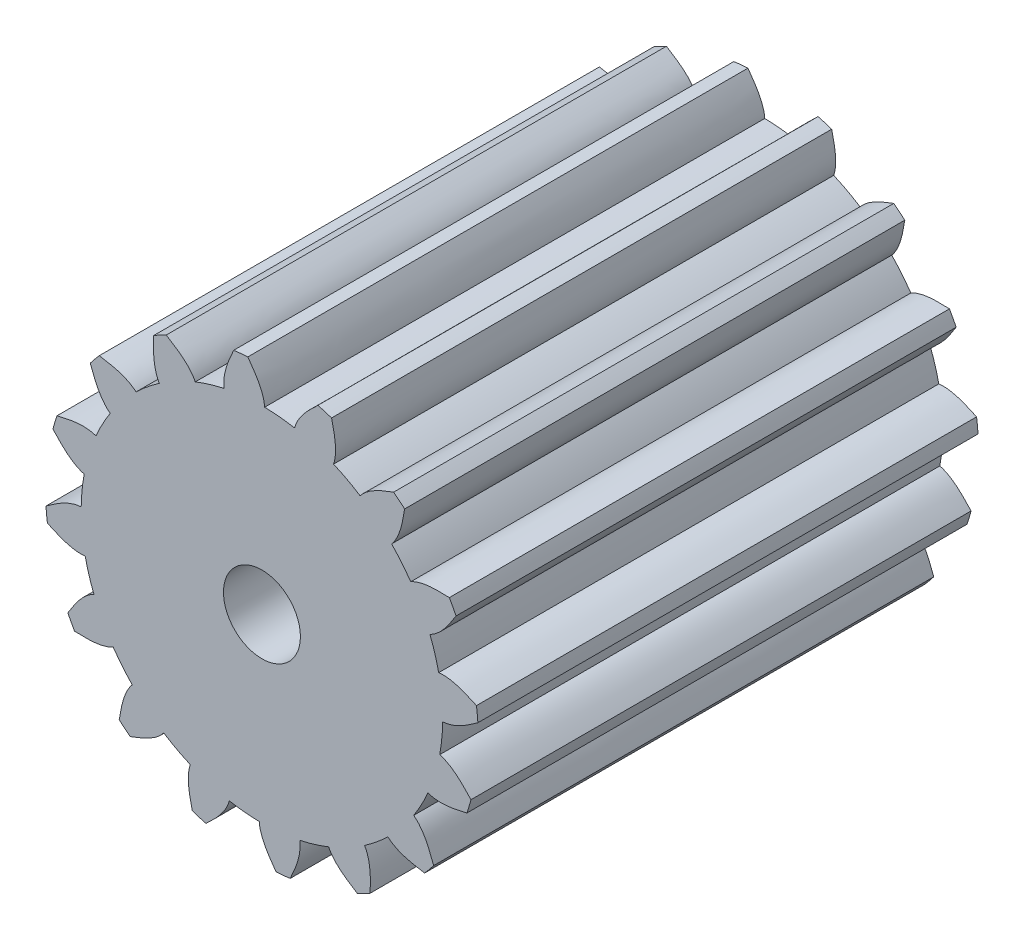
from build123d import *

# Parameters (mm, degrees)
BOSS_EXTRUDE7_DEPTH = 5.2
CIRPATTERN1_COUNT   = 16
DIAMETRO_BASE_R     = 1.879385242
BOSS_EXTRUDE9_DEPTH = 5.2
MOZZO_R             = 0.4
CUT_EXTRUDE1_DEPTH  = 5.2


with BuildPart() as part:
    # profilo → Boss-Extrude7 (new body)
    with BuildSketch(Plane.XY):
        with BuildLine():
            Line((-0.220538566, 2.239165635), (-0.184211967, 1.870335488))
            ThreePointArc((-0.184211967, 1.870335488), (-0.078225963, 1.87775653), (0.028010042, 1.879176501))
            add(Edge.make_bspline(
                [(-0.14670524, 2.245212144), (-0.068888242, 2.136288179), (0.01902302, 2.014536344), (0.028010042, 1.879176501)],
                knots=[0.201514188, 0.201514188, 0.201514188, 0.201514188, 1, 1, 1, 1], degree=3))
            ThreePointArc((-0.14670524, 2.245212144), (-0.18364679, 2.242492777), (-0.220538566, 2.239165635))
        make_face()
    extrude(amount=BOSS_EXTRUDE7_DEPTH)

    # Mirror1: part across plane


with BuildPart() as part_1:
    add(part.part)
    add(part.part.mirror(Plane(origin=(0, 0, 0), x_dir=(0, 0, 1), z_dir=(0.9951847266721969, 0.09801714032956144, 0))))


with BuildPart() as cirpattern1_1:
    # CirPattern1: pattern copy
    add(part_1.part.rotate(Axis((0, 0, 5.2), (0, 0, 1)), 1 * 360 / CIRPATTERN1_COUNT))


with BuildPart() as cirpattern1_2:
    # CirPattern1: pattern copy
    add(part_1.part.rotate(Axis((0, 0, 5.2), (0, 0, 1)), 2 * 360 / CIRPATTERN1_COUNT))


with BuildPart() as cirpattern1_3:
    # CirPattern1: pattern copy
    add(part_1.part.rotate(Axis((0, 0, 5.2), (0, 0, 1)), 3 * 360 / CIRPATTERN1_COUNT))


with BuildPart() as cirpattern1_4:
    # CirPattern1: pattern copy
    add(part_1.part.rotate(Axis((0, 0, 5.2), (0, 0, 1)), 4 * 360 / CIRPATTERN1_COUNT))


with BuildPart() as cirpattern1_5:
    # CirPattern1: pattern copy
    add(part_1.part.rotate(Axis((0, 0, 5.2), (0, 0, 1)), 5 * 360 / CIRPATTERN1_COUNT))


with BuildPart() as cirpattern1_6:
    # CirPattern1: pattern copy
    add(part_1.part.rotate(Axis((0, 0, 5.2), (0, 0, 1)), 6 * 360 / CIRPATTERN1_COUNT))


with BuildPart() as cirpattern1_7:
    # CirPattern1: pattern copy
    add(part_1.part.rotate(Axis((0, 0, 5.2), (0, 0, 1)), 7 * 360 / CIRPATTERN1_COUNT))


with BuildPart() as cirpattern1_8:
    # CirPattern1: pattern copy
    add(part_1.part.rotate(Axis((0, 0, 5.2), (0, 0, 1)), 8 * 360 / CIRPATTERN1_COUNT))


with BuildPart() as cirpattern1_9:
    # CirPattern1: pattern copy
    add(part_1.part.rotate(Axis((0, 0, 5.2), (0, 0, 1)), 9 * 360 / CIRPATTERN1_COUNT))


with BuildPart() as cirpattern1_10:
    # CirPattern1: pattern copy
    add(part_1.part.rotate(Axis((0, 0, 5.2), (0, 0, 1)), 10 * 360 / CIRPATTERN1_COUNT))


with BuildPart() as cirpattern1_11:
    # CirPattern1: pattern copy
    add(part_1.part.rotate(Axis((0, 0, 5.2), (0, 0, 1)), 11 * 360 / CIRPATTERN1_COUNT))


with BuildPart() as cirpattern1_12:
    # CirPattern1: pattern copy
    add(part_1.part.rotate(Axis((0, 0, 5.2), (0, 0, 1)), 12 * 360 / CIRPATTERN1_COUNT))


with BuildPart() as cirpattern1_13:
    # CirPattern1: pattern copy
    add(part_1.part.rotate(Axis((0, 0, 5.2), (0, 0, 1)), 13 * 360 / CIRPATTERN1_COUNT))


with BuildPart() as cirpattern1_14:
    # CirPattern1: pattern copy
    add(part_1.part.rotate(Axis((0, 0, 5.2), (0, 0, 1)), 14 * 360 / CIRPATTERN1_COUNT))


with BuildPart() as cirpattern1_15:
    # CirPattern1: pattern copy
    add(part_1.part.rotate(Axis((0, 0, 5.2), (0, 0, 1)), 15 * 360 / CIRPATTERN1_COUNT))


with BuildPart() as part_2:
    add(part_1.part)

    add(cirpattern1_1.part)  # Boss-Extrude9 merges CirPattern1_1

    add(cirpattern1_2.part)  # Boss-Extrude9 merges CirPattern1_2

    add(cirpattern1_3.part)  # Boss-Extrude9 merges CirPattern1_3

    add(cirpattern1_4.part)  # Boss-Extrude9 merges CirPattern1_4

    add(cirpattern1_5.part)  # Boss-Extrude9 merges CirPattern1_5

    add(cirpattern1_6.part)  # Boss-Extrude9 merges CirPattern1_6

    add(cirpattern1_7.part)  # Boss-Extrude9 merges CirPattern1_7

    add(cirpattern1_8.part)  # Boss-Extrude9 merges CirPattern1_8

    add(cirpattern1_9.part)  # Boss-Extrude9 merges CirPattern1_9

    add(cirpattern1_10.part)  # Boss-Extrude9 merges CirPattern1_10

    add(cirpattern1_11.part)  # Boss-Extrude9 merges CirPattern1_11

    add(cirpattern1_12.part)  # Boss-Extrude9 merges CirPattern1_12

    add(cirpattern1_13.part)  # Boss-Extrude9 merges CirPattern1_13

    add(cirpattern1_14.part)  # Boss-Extrude9 merges CirPattern1_14

    add(cirpattern1_15.part)  # Boss-Extrude9 merges CirPattern1_15
    # diametro base → Boss-Extrude9 (add)
    with BuildSketch(Plane.XY):
        Circle(DIAMETRO_BASE_R)
    extrude(amount=BOSS_EXTRUDE9_DEPTH)

    # mozzo → Cut-Extrude1 (cut)
    with BuildSketch(Plane.XY):
        Circle(MOZZO_R)
    extrude(amount=CUT_EXTRUDE1_DEPTH, mode=Mode.SUBTRACT)


solid = part_2.part
